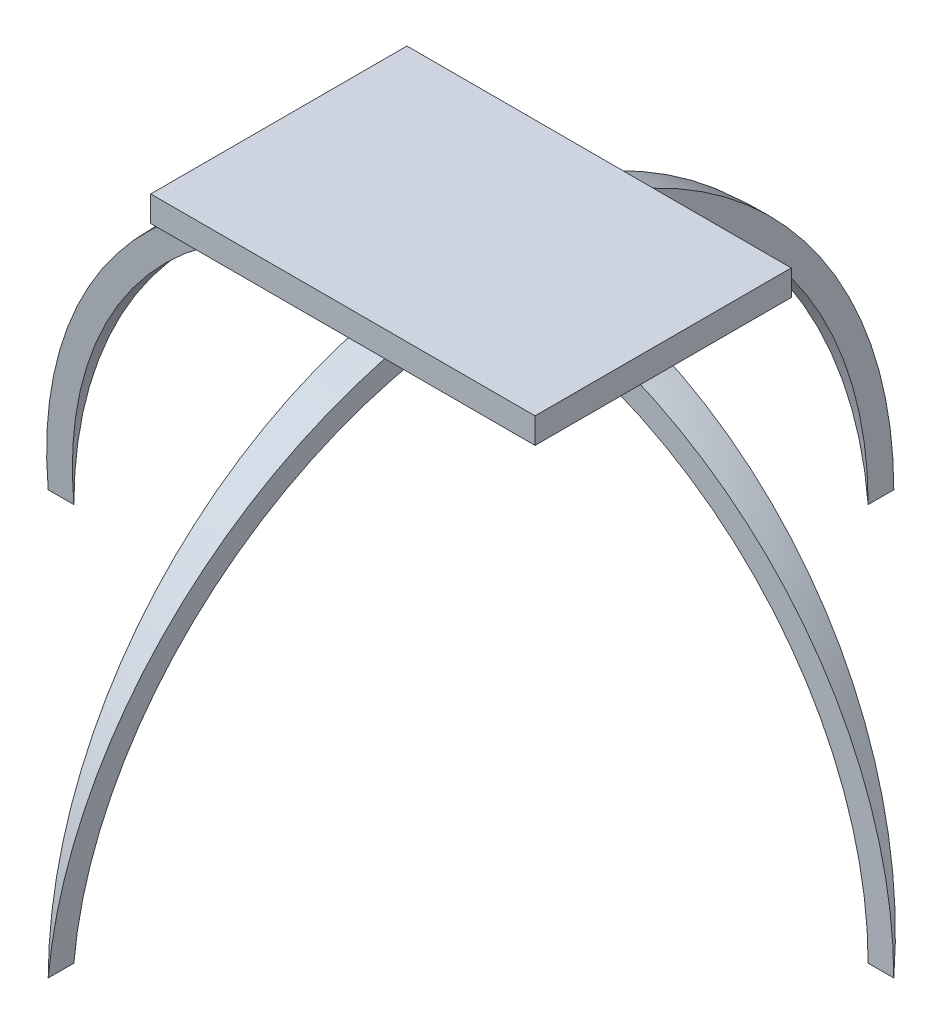
from build123d import *
from build123d.topology import SkipClean

# Parameters (mm, degrees)
REVOLVE1_ANGLE      = 5
CIRPATTERN1_COUNT   = 4
BOSS_EXTRUDE2_START = 160
SKETCH4_W           = 150
SKETCH4_H           = 100
BOSS_EXTRUDE2_DEPTH = 10


with BuildPart() as part:
    # Sketch1 → Revolve1 (revolve)
    with BuildSketch(Plane.XY):
        with BuildLine():
            Line((0, 165), (0, 155))
            ThreePointArc((0, 155), (-109.601551084, 109.601551084), (-155, 0))
            Line((-155, 0), (-165, 0))
            ThreePointArc((-165, 0), (-116.672618896, 116.672618896), (0, 165))
        make_face()
    revolve(axis=Axis((-165, 0, 0), (1, 0, 0)), revolution_arc=REVOLVE1_ANGLE)


with BuildPart() as cirpattern1_1:
    # CirPattern1: pattern copy
    add(part.part.rotate(Axis((0, 0, 0), (0, 1, 0)), 1 * 360 / CIRPATTERN1_COUNT))


with BuildPart() as cirpattern1_2:
    # CirPattern1: pattern copy
    add(part.part.rotate(Axis((0, 0, 0), (0, 1, 0)), 2 * 360 / CIRPATTERN1_COUNT))


with BuildPart() as cirpattern1_3:
    # CirPattern1: pattern copy
    add(part.part.rotate(Axis((0, 0, 0), (0, 1, 0)), 3 * 360 / CIRPATTERN1_COUNT))


with BuildPart() as part_1:
    with SkipClean():  # the faces are left unmerged after this step: merging them gives an invalid solid
        add(part.part)

        add(cirpattern1_1.part)  # Boss-Extrude2 merges CirPattern1_1

        add(cirpattern1_2.part)  # Boss-Extrude2 merges CirPattern1_2

        add(cirpattern1_3.part)  # Boss-Extrude2 merges CirPattern1_3
        # Sketch4 → Boss-Extrude2 (add)
        with BuildSketch(Plane(origin=(0, 0, 0), x_dir=(1, 0, 0), z_dir=(0, 1, 0)).offset(BOSS_EXTRUDE2_START)):
            Rectangle(SKETCH4_W, SKETCH4_H)
        extrude(amount=BOSS_EXTRUDE2_DEPTH)


solid = part_1.part
